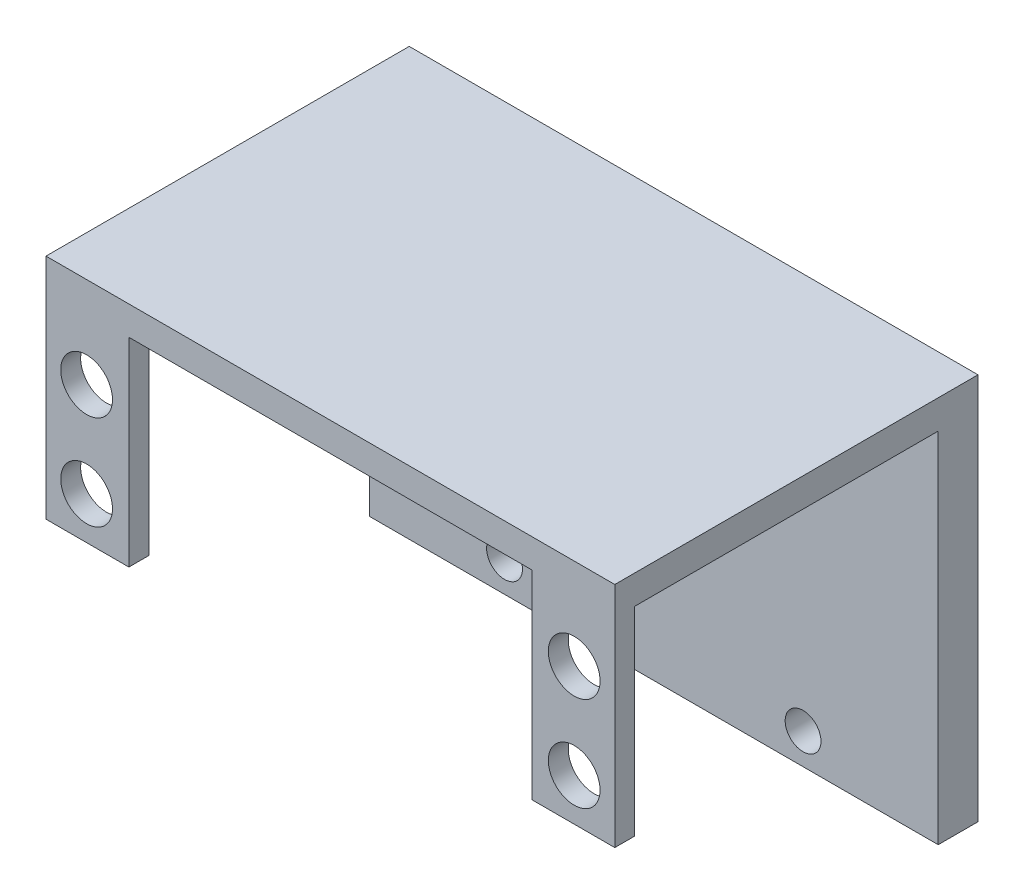
from build123d import *

# Parameters (mm, degrees)
SKETCH_1_R           = 2.6
EXTRUDE_3_DEPTH      = 2
EXTRUDE_5_DEPTH      = 18.7
EXTRUDE_5_DEPTH_BACK = 2
SKETCH_9_W           = 57.159649592
SKETCH_9_H           = 11.9
EXTRUDE_6_DEPTH      = 31.5
SKETCH_10_W          = 57.159649592
SKETCH_10_H          = 11.9
EXTRUDE_7_DEPTH      = 5
SKETCH_11_W          = 57.159649592
SKETCH_11_H          = 36.5
CUT_EXTRUDE_1_DEPTH  = 10
SKETCH_12_W          = 57.159649592
SKETCH_12_H          = 4
EXTRUDE_8_DEPTH      = 35
SKETCH_13_R          = 1.8
CUT_EXTRUDE_2_DEPTH  = 10
SKETCH_14_W          = 57.159649592
SKETCH_14_H          = 36.5
EXTRUDE_9_DEPTH      = 2
CUT_EXTRUDE_3_DEPTH  = 1


with BuildPart() as part:
    # 草图1 → 凸台-拉伸3 (new body)
    # profile 1 of 2: a face of its own
    with BuildSketch(Plane.XY):
        Polygon((-28.579824796, -9), (-20.25, -9), (-20.25, 9), (-20.25, 10), (20.25, 10), (20.25, 9), (20.25, -9), (28.579824796, -9), (28.579824796, 12), (-28.579824796, 12), align=None)
        with Locations((-24.5, -4.75)):
            Circle(SKETCH_1_R, mode=Mode.SUBTRACT)
        with Locations((24.5, -4.75)):
            Circle(SKETCH_1_R, mode=Mode.SUBTRACT)
        with Locations((-24.5, 4.75)):
            Circle(SKETCH_1_R, mode=Mode.SUBTRACT)
        with Locations((24.5, 4.75)):
            Circle(SKETCH_1_R, mode=Mode.SUBTRACT)
    # profile 2 of 2: a face of its own
    with BuildSketch(Plane.XY):
        Polygon((-28.579824796, -9), (-20.25, -9), (-20.25, 9), (-20.25, 10), (20.25, 10), (20.25, 9), (20.25, -9), (28.579824796, -9), (28.579824796, 12), (-28.579824796, 12), align=None)
        with Locations((-24.5, -4.75)):
            Circle(SKETCH_1_R, mode=Mode.SUBTRACT)
        with Locations((24.5, -4.75)):
            Circle(SKETCH_1_R, mode=Mode.SUBTRACT)
        with Locations((-24.5, 4.75)):
            Circle(SKETCH_1_R, mode=Mode.SUBTRACT)
        with Locations((24.5, 4.75)):
            Circle(SKETCH_1_R, mode=Mode.SUBTRACT)
    extrude(amount=EXTRUDE_3_DEPTH)

    # 草图3 → 凸台-拉伸5 (add, two sides: drawn at the far end of the back side and taken through both)
    with BuildSketch(Plane(origin=(0, 0, 0), x_dir=(-1, 0, 0), z_dir=(0, 0, -1)).offset(-EXTRUDE_5_DEPTH_BACK)):
        Polygon((-28.579824796, 12), (-28.579824796, 10), (28.579824796, 10), (28.579824796, 12), (28.579824796, 21.9), (-28.579824796, 21.9), align=None)
    extrude(amount=EXTRUDE_5_DEPTH + EXTRUDE_5_DEPTH_BACK)

    # 草图9 → 凸台-拉伸6 (add)
    with BuildSketch(Plane.XY.offset(2)):
        with Locations((0, 15.95)):
            Rectangle(SKETCH_9_W, SKETCH_9_H)
    extrude(amount=-EXTRUDE_6_DEPTH)

    # 草图10 → 凸台-拉伸7 (add)
    with BuildSketch(Plane(origin=(0, 0, -29.5), x_dir=(-1, 0, 0), z_dir=(0, 0, -1))):
        with Locations((0, 15.95)):
            Rectangle(SKETCH_10_W, SKETCH_10_H)
    extrude(amount=EXTRUDE_7_DEPTH)

    # 草图11 → 切除-拉伸1 (cut)
    with BuildSketch(Plane(origin=(0, 21.9, 0), x_dir=(1, 0, 0), z_dir=(0, 1, 0))):
        with Locations((0, 16.25)):
            Rectangle(SKETCH_11_W, SKETCH_11_H)
    extrude(amount=-CUT_EXTRUDE_1_DEPTH, mode=Mode.SUBTRACT)

    # 草图12 → 凸台-拉伸8 (add)
    with BuildSketch(Plane.XZ.offset(-10)):
        with Locations((0, -32.5)):
            Rectangle(SKETCH_12_W, SKETCH_12_H)
    extrude(amount=EXTRUDE_8_DEPTH)

    # 草图13 → 切除-拉伸2 (cut)
    with BuildSketch(Plane(origin=(0, 0, -34.5), x_dir=(-1, 0, 0), z_dir=(0, 0, -1))):
        with Locations((-15, 8.10231344)):
            Circle(SKETCH_13_R)
        with Locations((15, -21.89768656)):
            Circle(SKETCH_13_R)
        with Locations((-15, -21.89768656)):
            Circle(SKETCH_13_R)
        with Locations((15, 8.10231344)):
            Circle(SKETCH_13_R)
    extrude(amount=-CUT_EXTRUDE_2_DEPTH, mode=Mode.SUBTRACT)

    # 草图14 → 凸台-拉伸9 (add)
    with BuildSketch(Plane(origin=(0, 11.9, 0), x_dir=(1, 0, 0), z_dir=(0, 1, 0))):
        with Locations((0, 16.25)):
            Rectangle(SKETCH_14_W, SKETCH_14_H)
    extrude(amount=EXTRUDE_9_DEPTH)

    # 草图15 → 切除-拉伸3 (cut)
    with BuildSketch(Plane.XZ.offset(-10)):
        Polygon((-28.579824796, -30.5), (28.579824796, -30.5), (28.579824796, 0), (20.25, 0), (20.25, 2), (-20.25, 2), (-20.25, 0), (-28.579824796, 0), align=None)
    extrude(amount=-CUT_EXTRUDE_3_DEPTH, mode=Mode.SUBTRACT)


solid = part.part
